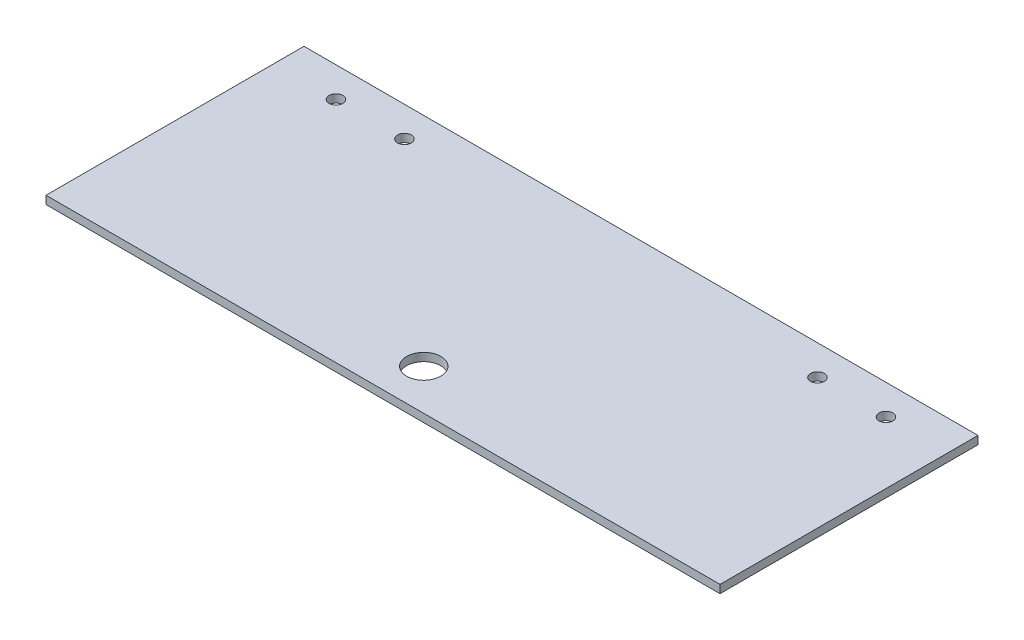
from build123d import *

# Parameters (mm, degrees)
SKETCH1_W           = 250
SKETCH1_H           = 95.7
SKETCH1_R           = 2.564
SKETCH1_R_2         = 6.35
BOSS_EXTRUDE1_DEPTH = 3


with BuildPart() as part:
    # Sketch1 → Boss-Extrude1 (new body)
    with BuildSketch(Plane(origin=(0, 0, 0), x_dir=(1, 0, 0), z_dir=(0, 1, 0))):
        with Locations((125, 47.85)):
            Rectangle(SKETCH1_W, SKETCH1_H)
        with Locations(Location((23, 84.56, 0), (0, 0, 270))):
            Circle(SKETCH1_R, mode=Mode.SUBTRACT)
        with Locations(Location((48.4, 84.56, 0), (0, 0, 270))):
            Circle(SKETCH1_R, mode=Mode.SUBTRACT)
        with Locations(Location((201.6, 84.56, 0), (0, 0, 90))):
            Circle(SKETCH1_R, mode=Mode.SUBTRACT)
        with Locations(Location((227, 84.56, 0), (0, 0, 90))):
            Circle(SKETCH1_R, mode=Mode.SUBTRACT)
        with Locations(Location((125, 15.1, 0), (0, 0, 270))):
            Circle(SKETCH1_R_2, mode=Mode.SUBTRACT)
    extrude(amount=BOSS_EXTRUDE1_DEPTH)


solid = part.part
